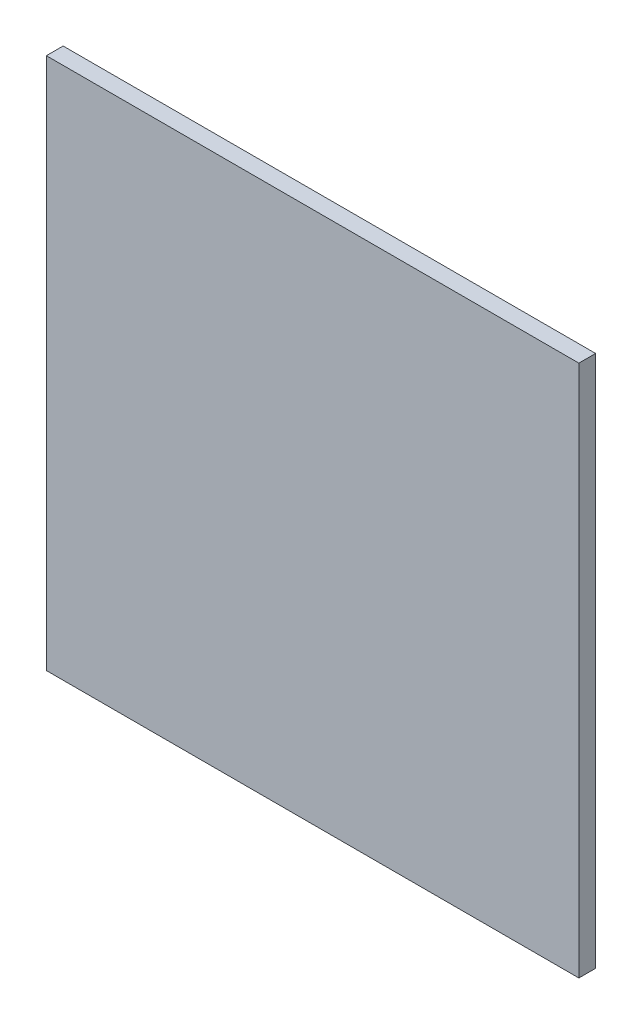
from build123d import *

# Parameters (mm, degrees)
SKETCH1_W           = 6.35
SKETCH1_H           = 6.35
BOSS_EXTRUDE1_DEPTH = 0.2


with BuildPart() as part:
    # Sketch1 → Boss-Extrude1 (new body)
    with BuildSketch(Plane.XY):
        with Locations((3.175, 3.175)):
            Rectangle(SKETCH1_W, SKETCH1_H)
    extrude(amount=BOSS_EXTRUDE1_DEPTH)


solid = part.part
